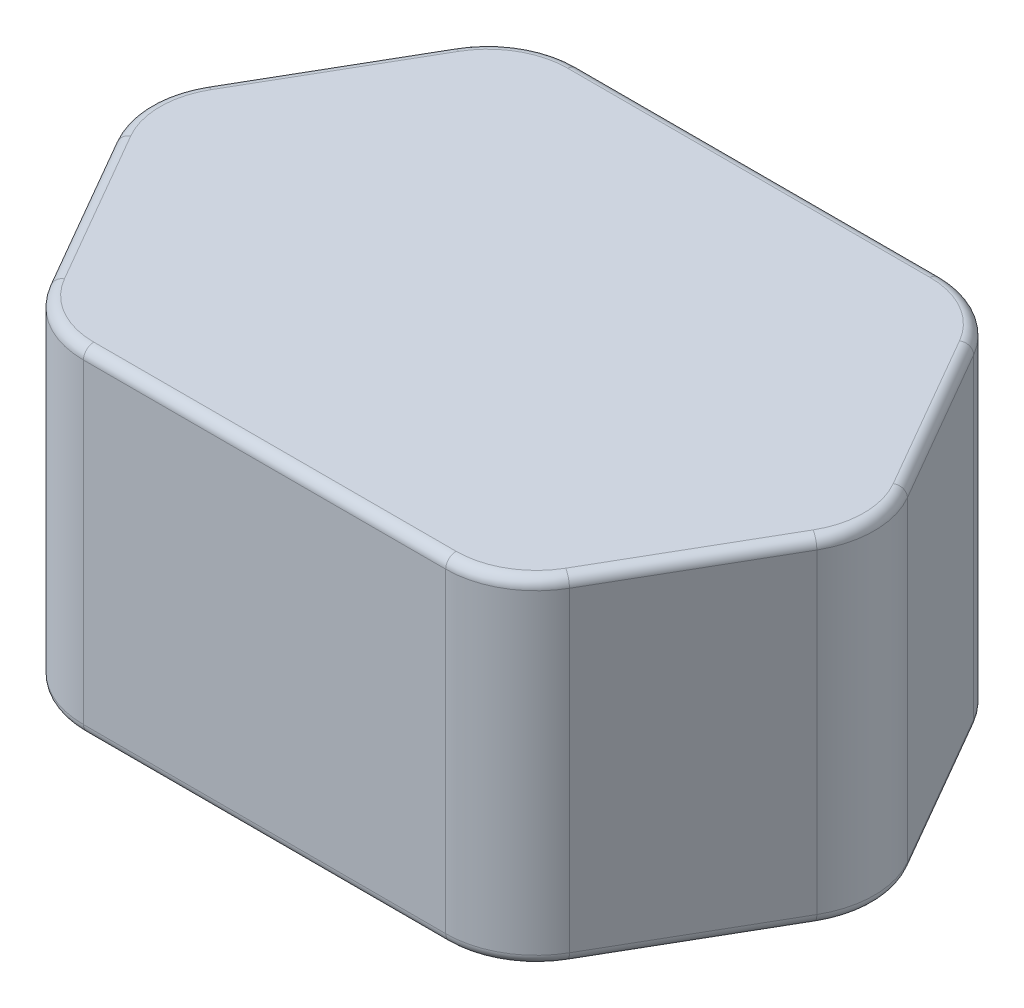
from build123d import *

# Parameters (mm, degrees)
EXTRUDE1_DEPTH = 65
FILLET1_R      = 2


with BuildPart() as part:
    # Sketch1 → Extrude1 (new body)
    with BuildSketch(Plane(origin=(0, 0, 0), x_dir=(1, 0, 0), z_dir=(0, 1, 0))):
        with BuildLine():
            Line((-15.155444566, 8.75), (2.344555434, 39.060889132))
            ThreePointArc((2.344555434, 39.060889132), (8.75, 45.466333699), (17.5, 47.810889132))
            Line((17.5, 47.810889132), (87.5, 47.810889132))
            ThreePointArc((87.5, 47.810889132), (96.25, 45.466333699), (102.655444566, 39.060889132))
            Line((102.655444566, 39.060889132), (120.155444566, 8.75))
            ThreePointArc((120.155444566, 8.75), (122.5, 0), (120.155444566, -8.75))
            Line((120.155444566, -8.75), (102.655444566, -39.060889132))
            ThreePointArc((102.655444566, -39.060889132), (96.25, -45.466333699), (87.5, -47.810889132))
            Line((87.5, -47.810889132), (17.5, -47.810889132))
            ThreePointArc((17.5, -47.810889132), (8.75, -45.466333699), (2.344555434, -39.060889132))
            Line((2.344555434, -39.060889132), (-15.155444566, -8.75))
            ThreePointArc((-15.155444566, -8.75), (-17.5, 0), (-15.155444566, 8.75))
        make_face()
    extrude(amount=EXTRUDE1_DEPTH)

    # Fillet1
    fillet1_edges = [part.edges().sort_by_distance(p)[0] for p in [
        (8.75, 65, 45.466333699),
        (-6.405444566, 0, -23.905444566),
        (8.75, 0, -45.466333699),
        (52.5, 0, -47.810889132),
        (96.25, 0, -45.466333699),
        (111.405444566, 0, -23.905444566),
        (122.5, 0, 0),
        (52.5, 65, 47.810889132),
        (111.405444566, 0, 23.905444566),
        (96.25, 0, 45.466333699),
        (52.5, 0, 47.810889132),
        (8.75, 0, 45.466333699),
        (-6.405444566, 0, 23.905444566),
        (-17.5, 0, 0),
        (96.25, 65, 45.466333699),
        (111.405444566, 65, 23.905444566),
        (122.5, 65, 0),
        (111.405444566, 65, -23.905444566),
        (96.25, 65, -45.466333699),
        (52.5, 65, -47.810889132),
        (8.75, 65, -45.466333699),
        (-6.405444566, 65, -23.905444566),
        (-17.5, 65, 0),
        (-6.405444566, 65, 23.905444566),
    ]]
    fillet(fillet1_edges, radius=FILLET1_R)


solid = part.part
